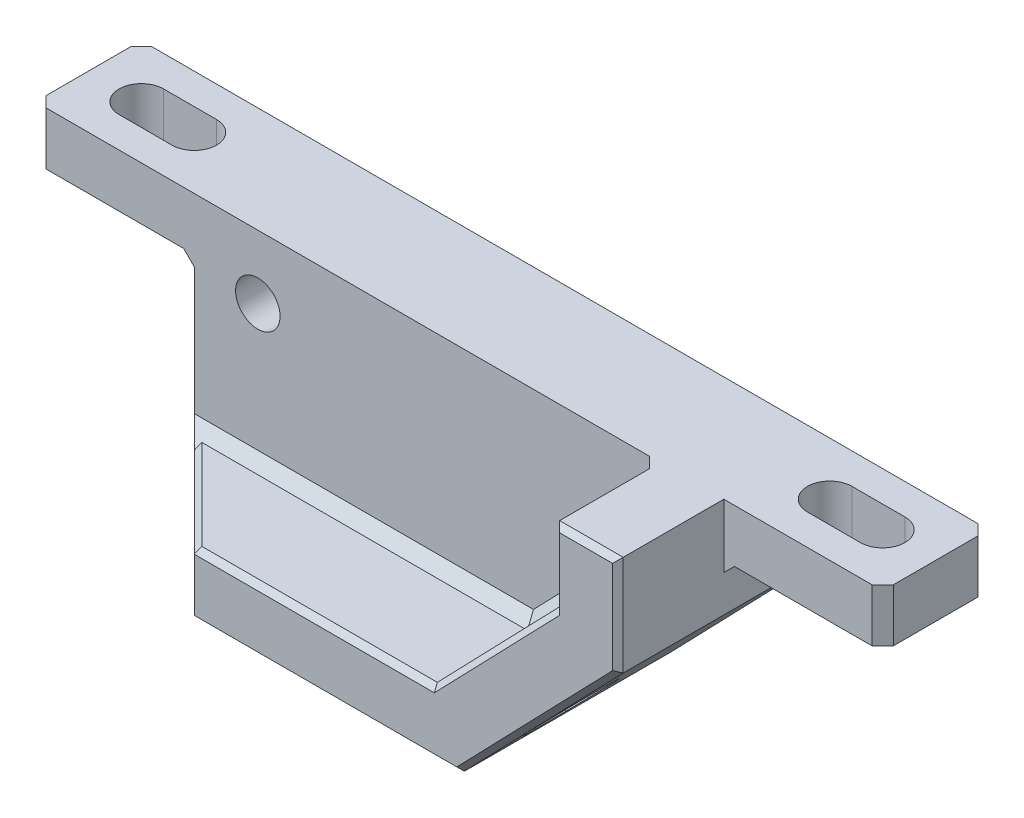
from build123d import *

# Parameters (mm, degrees)
SKICA1_W                 = 50
SKICA1_H                 = 25
P_IDAT_VYSUNUT_M1_DEPTH  = 10
P_IDAT_VYSUNUT_M2_DEPTH  = 10
SKICA3_R                 = 2.1
ODEBRAT_VYSUNUT_M1_DEPTH = 10
ODEBRAT_VYSUNUT_M2_DEPTH = 10
SKICA5_R                 = 2.1
ODEBRAT_VYSUNUT_M3_DEPTH = 10
SKICA6_W                 = 15
SKICA6_H                 = 10
P_IDAT_VYSUNUT_M3_DEPTH  = 5
ODEBRAT_VYSUNUT_M5_DEPTH = 3.5
ODEBRAT_VYSUNUT_M6_DEPTH = 4
ZKOSEN_1_SIZE            = 10
ODEBRAT_VYSUNUT_M7_DEPTH = 5
ZKOSEN_3_SIZE            = 1
ZKOSEN_4_SIZE            = 0.5
ZKOSEN_5_SIZE            = 1
ZKOSEN_7_SIZE            = 1


with BuildPart() as part:
    # Skica1 → Přidat vysunutím1 (new body)
    with BuildSketch(Plane.XY):
        with Locations((25, 12.5)):
            Rectangle(SKICA1_W, SKICA1_H)
    extrude(amount=P_IDAT_VYSUNUT_M1_DEPTH)

    # Skica2 → Přidat vysunutím2 (add)
    with BuildSketch(Plane.XY.offset(10)):
        Polygon((0, 0), (35, 0), (50, 15.532954707), (50, 25), (44, 25), (44, 17.957112062), (32.453151103, 6), (0, 6), align=None)
    extrude(amount=P_IDAT_VYSUNUT_M2_DEPTH)

    # Skica3 → Odebrat vysunutím1 (cut)
    with BuildSketch(Plane.XY.offset(10)):
        with Locations((6, 19)):
            Circle(SKICA3_R)
    extrude(amount=-ODEBRAT_VYSUNUT_M1_DEPTH, mode=Mode.SUBTRACT)

    # Skica4 → Odebrat vysunutím2 (cut)
    with BuildSketch(Plane.XY.offset(10)):
        Polygon((50, 15.532954707), (35, 0), (50, 0), align=None)
    extrude(amount=-ODEBRAT_VYSUNUT_M2_DEPTH, mode=Mode.SUBTRACT)

    # Skica5 → Odebrat vysunutím3 (cut)
    with BuildSketch(Plane(origin=(18.110741192, -17.489339473, 0), x_dir=(0, 0, -1), z_dir=(0.7193398003386524, -0.6946583704589961, 0))):
        with Locations(Location((-15, 32.313042966, 0), (0, 0, 90))):
            Circle(SKICA5_R)
    extrude(amount=-ODEBRAT_VYSUNUT_M3_DEPTH, mode=Mode.SUBTRACT)

    # Skica6 → Přidat vysunutím3 (add)
    with BuildSketch(Plane(origin=(0, 25, 0), x_dir=(1, 0, 0), z_dir=(0, 1, 0))):
        with Locations((-7.5, -5)):
            Rectangle(SKICA6_W, SKICA6_H)
        with Locations((57.5, -5)):
            Rectangle(SKICA6_W, SKICA6_H)
    extrude(amount=-P_IDAT_VYSUNUT_M3_DEPTH)

    # Skica9 → Odebrat vysunutím5 (cut)
    with BuildSketch(Plane(origin=(18.110741192, -17.489339473, 0), x_dir=(0, 0, -1), z_dir=(0.7193398003386524, -0.6946583704589961, 0))):
        Polygon((-19.156921938, 32.313042966), (-17.078460969, 28.713042966), (-12.921539031, 28.713042966), (-10.843078062, 32.313042966), (-12.921539031, 35.913042966), (-17.078460969, 35.913042966), align=None)
    extrude(amount=-ODEBRAT_VYSUNUT_M5_DEPTH, mode=Mode.SUBTRACT)

    # Skica10 → Odebrat vysunutím6 (cut)
    with BuildSketch(Plane(origin=(0, 0, 0), x_dir=(-1, 0, 0), z_dir=(0, 0, -1))):
        Polygon((-6, 23.156921938), (-9.6, 21.078460969), (-9.6, 16.921539031), (-6, 14.843078062), (-2.4, 16.921539031), (-2.4, 21.078460969), align=None)
    extrude(amount=-ODEBRAT_VYSUNUT_M6_DEPTH, mode=Mode.SUBTRACT)

    # Zkosení1
    zkosen_1_edges = [part.edges().sort_by_distance(p)[0] for p in [
        (0, 3, 20),
    ]]
    chamfer(zkosen_1_edges, length=ZKOSEN_1_SIZE)

    # Skica11 → Odebrat vysunutím7 (cut)
    with BuildSketch(Plane.XZ.offset(-20)):
        with BuildLine():
            Line((-10, 7.1), (-5, 7.1))
            ThreePointArc((-5, 7.1), (-2.9, 5), (-5, 2.9))
            Line((-5, 2.9), (-10, 2.9))
            ThreePointArc((-10, 2.9), (-12.1, 5), (-10, 7.1))
        make_face()
        with BuildLine():
            Line((55, 7.1), (60, 7.1))
            ThreePointArc((60, 7.1), (62.1, 5), (60, 2.9))
            Line((60, 2.9), (55, 2.9))
            ThreePointArc((55, 2.9), (52.9, 5), (55, 7.1))
        make_face()
    extrude(amount=-ODEBRAT_VYSUNUT_M7_DEPTH, mode=Mode.SUBTRACT)

    # Zkosení3
    zkosen_3_edges = [part.edges().sort_by_distance(p)[0] for p in [
        (44, 21.478556031, 10),
        (38.226575551, 11.978556031, 10),
        (16.226575551, 6, 10),
    ]]
    chamfer(zkosen_3_edges, length=ZKOSEN_3_SIZE)

    # Zkosení4
    zkosen_4_edges = [part.edges().sort_by_distance(p)[0] for p in [
        (22.5, 0, 20),
        (5, 0, 15),
        (5.5, 6, 15.5),
        (42.5, 7.766477353, 20),
        (50, 20.266477353, 20),
        (47, 25, 20),
        (44, 21.478556031, 20),
        (38.226575551, 11.978556031, 20),
        (21.226575551, 6, 20),
    ]]
    chamfer(zkosen_4_edges, length=ZKOSEN_4_SIZE)

    # Zkosení5
    zkosen_5_edges = [part.edges().sort_by_distance(p)[0] for p in [
        (0, 20, 5),
        (50, 20, 5),
    ]]
    chamfer(zkosen_5_edges, length=ZKOSEN_5_SIZE)

    # Zkosení7
    zkosen_7_edges = [part.edges().sort_by_distance(p)[0] for p in [
        (-15, 22.5, 10),
        (-15, 22.5, 0),
        (65, 22.5, 0),
        (65, 22.5, 10),
    ]]
    chamfer(zkosen_7_edges, length=ZKOSEN_7_SIZE)


solid = part.part
